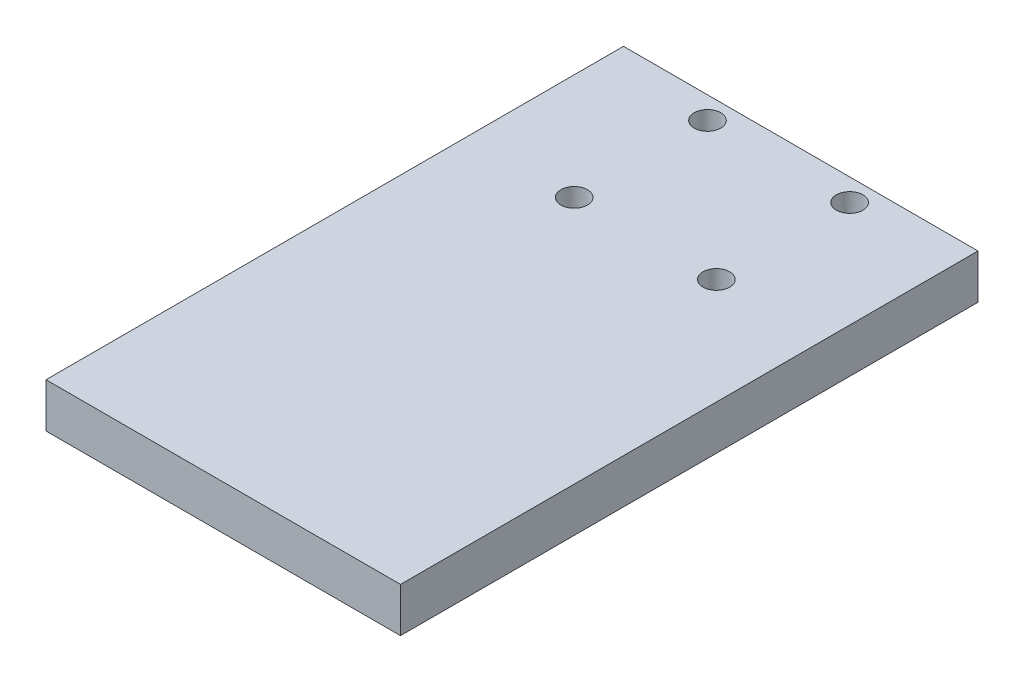
from build123d import *

# Parameters (mm, degrees)
SKETCH_1_W          = 39.9
SKETCH_1_H          = 20
EXTRUDE_1_DEPTH     = 5
SKETCH_2_R          = 1.5
CUT_EXTRUDE_1_DEPTH = 5
SKETCH_4_W          = 39.9
SKETCH_4_H          = 5
EXTRUDE_2_DEPTH     = 45


with BuildPart() as part:
    # 草图1 → 凸台-拉伸1 (new body)
    with BuildSketch(Plane(origin=(0, 0, 0), x_dir=(1, 0, 0), z_dir=(0, 1, 0))):
        with Locations((-19.95, 10)):
            Rectangle(SKETCH_1_W, SKETCH_1_H)
    extrude(amount=EXTRUDE_1_DEPTH)

    # 草图2 → 切除-拉伸1 (cut)
    with BuildSketch(Plane(origin=(0, 5, 0), x_dir=(1, 0, 0), z_dir=(0, 1, 0))):
        with Locations(Location((-27.95, 17.5, 0), (0, 0, 270))):
            Circle(SKETCH_2_R)
        with Locations(Location((-11.95, 17.5, 0), (0, 0, 270))):
            Circle(SKETCH_2_R)
        with Locations(Location((-11.95, 2.5, 0), (0, 0, 90))):
            Circle(SKETCH_2_R)
        with Locations(Location((-27.95, 2.5, 0), (0, 0, 90))):
            Circle(SKETCH_2_R)
    extrude(amount=-CUT_EXTRUDE_1_DEPTH, mode=Mode.SUBTRACT)

    # 草图4 → 凸台-拉伸2 (add)
    with BuildSketch(Plane.XY):
        with Locations((-19.95, 2.5)):
            Rectangle(SKETCH_4_W, SKETCH_4_H)
    extrude(amount=EXTRUDE_2_DEPTH)


solid = part.part
